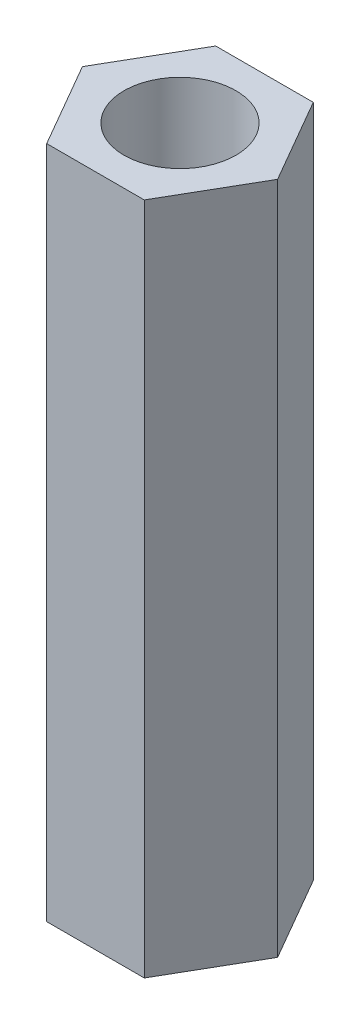
from build123d import *

# Parameters (mm, degrees)
SKETCH1_R           = 9.398
BOSS_EXTRUDE1_DEPTH = 74.93
SKETCH2_R           = 6.223
CUT_EXTRUDE1_DEPTH  = 69.088
BOSS_EXTRUDE2_START = -74.93
BOSS_EXTRUDE2_DEPTH = 74.93
CUT_EXTRUDE6_DEPTH  = 4.318
CIRPATTERN2_COUNT   = 6


with BuildPart() as part:
    # Sketch1 → Boss-Extrude1 (new body)
    with BuildSketch(Plane(origin=(0, 0, 0), x_dir=(1, 0, 0), z_dir=(0, 1, 0))):
        with Locations(Location((0, 0, 0), (0, 0, 270))):
            Circle(SKETCH1_R)
    extrude(amount=BOSS_EXTRUDE1_DEPTH)

    # Sketch2 → Cut-Extrude1 (cut)
    with BuildSketch(Plane(origin=(0, 74.93, 0), x_dir=(1, 0, 0), z_dir=(0, 1, 0))):
        with Locations(Location((0, 0, 0), (0, 0, 270))):
            Circle(SKETCH2_R)
    extrude(amount=-CUT_EXTRUDE1_DEPTH, mode=Mode.SUBTRACT)

    # Sketch7 → Boss-Extrude2 (add)
    with BuildSketch(Plane(origin=(0, 74.93, 0), x_dir=(1, 0, 0), z_dir=(0, 1, 0)).offset(BOSS_EXTRUDE2_START)):
        with BuildLine():
            ThreePointArc((-8.138906715, 4.699000052), (-4.698999978, 8.138906757), (-9e-09, 9.398))
            Line((-9e-09, 9.398), (-5.42593783, 9.398))
            Line((-5.42593783, 9.398), (-8.138906715, 4.699000052))
        make_face()
        with BuildLine():
            ThreePointArc((-9e-09, 9.398), (4.69899997, 8.138906762), (8.138906715, 4.699000052))
            Line((8.138906715, 4.699000052), (5.42593783, 9.398))
            Line((5.42593783, 9.398), (-9e-09, 9.398))
        make_face()
        with BuildLine():
            Line((8.138906731, -4.699000024), (10.85187566, 0))
            Line((10.85187566, 0), (8.138906715, 4.699000052))
            ThreePointArc((8.138906715, 4.699000052), (9.077770908, 2.432381415), (9.398, 0))
            ThreePointArc((9.398, 0), (9.077770912, -2.432381399), (8.138906731, -4.699000024))
        make_face()
        with BuildLine():
            Line((5.42593783, -9.398), (8.138906731, -4.699000024))
            ThreePointArc((8.138906731, -4.699000024), (4.698999988, -8.138906752), (0, -9.398))
            Line((0, -9.398), (5.42593783, -9.398))
        make_face()
        with BuildLine():
            Line((-5.42593783, -9.398), (0, -9.398))
            ThreePointArc((0, -9.398), (-4.699000032, -8.138906726), (-8.138906781, -4.698999937))
            Line((-8.138906781, -4.698999937), (-5.42593783, -9.398))
        make_face()
        with BuildLine():
            ThreePointArc((-8.138906781, -4.698999937), (-9.398, 6.6e-08), (-8.138906715, 4.699000052))
            Line((-8.138906715, 4.699000052), (-10.85187566, 0))
            Line((-10.85187566, 0), (-8.138906781, -4.698999937))
        make_face()
    extrude(amount=BOSS_EXTRUDE2_DEPTH)

    # Sketch8 → Cut-Extrude6 (cut)
    with BuildSketch(Plane.XZ):
        Polygon((-1.75976362, -5.588), (-2.492998462, -4.318), (-3.959468146, -4.318), (-4.692702988, -5.588), (-3.959468146, -6.858), (-2.492998462, -6.858), align=None)
    cut_extrude6 = extrude(amount=-CUT_EXTRUDE6_DEPTH, mode=Mode.SUBTRACT)

    # CirPattern2: Cut-Extrude6 ×6 about axis
    cirpattern2_axis = Axis((0.06001178, 0, 0.103943452), (0, 1, 0))
    for i in range(1, CIRPATTERN2_COUNT):
        add(cut_extrude6.rotate(cirpattern2_axis, i * 360 / CIRPATTERN2_COUNT), mode=Mode.SUBTRACT)


solid = part.part
